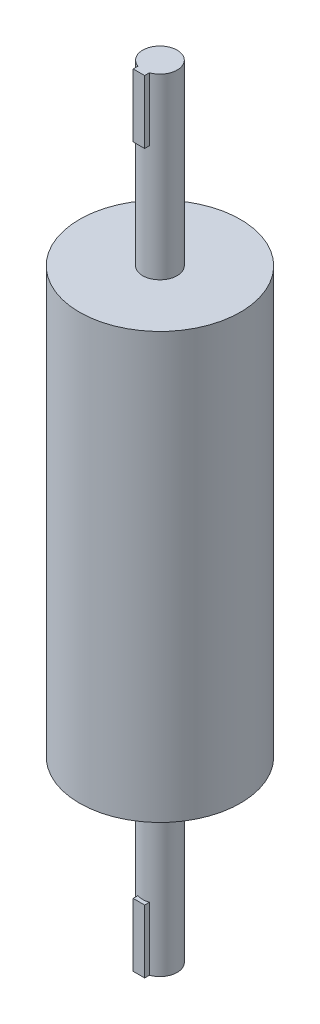
from build123d import *

# Parameters (mm, degrees)
SKETCH1_R            = 70
BOSS_EXTRUDE1_DEPTH  = 370
SKETCH2_R            = 10
BOSS_EXTRUDE2_DEPTH  = 100
BOSS_EXTRUDE3_START  = 100
SKETCH3_R            = 10
BOSS_EXTRUDE3_DEPTH  = 100
BOSS_EXTRUDE4_START  = -25
BOSS_EXTRUDE4_DEPTH  = 25
BOSS_EXTRUDE5_DEPTH  = 25
SKETCH6_R            = 15
BOSS_EXTRUDE6_DEPTH  = 570
BOSS_EXTRUDE7_START  = 55
SKETCH7_R            = 15
BOSS_EXTRUDE7_DEPTH  = 55
SKETCH8_R            = 15
BOSS_EXTRUDE8_DEPTH  = 55
BOSS_EXTRUDE9_DEPTH  = 55
BOSS_EXTRUDE10_START = -55
BOSS_EXTRUDE10_DEPTH = 55


with BuildPart() as part:
    # Sketch1 → Boss-Extrude1 (new body)
    with BuildSketch(Plane(origin=(0, 0, 0), x_dir=(1, 0, 0), z_dir=(0, 1, 0))):
        with Locations(Location((0, 0, 0), (0, 0, 270))):
            Circle(SKETCH1_R)
    extrude(amount=BOSS_EXTRUDE1_DEPTH)

    # Sketch2 → Boss-Extrude2 (add)
    with BuildSketch(Plane(origin=(0, 370, 0), x_dir=(1, 0, 0), z_dir=(0, 1, 0))):
        with Locations(Location((0, 0, 0), (0, 0, 270))):
            Circle(SKETCH2_R)
    extrude(amount=BOSS_EXTRUDE2_DEPTH)

    # Sketch3 → Boss-Extrude3 (add)
    with BuildSketch(Plane.XZ.offset(BOSS_EXTRUDE3_START)):
        with Locations(Location((0, 0, 0), (0, 0, 90))):
            Circle(SKETCH3_R)
    extrude(amount=-BOSS_EXTRUDE3_DEPTH)

    # Sketch4 → Boss-Extrude4 (add)
    with BuildSketch(Plane(origin=(0, 470, 0), x_dir=(1, 0, 0), z_dir=(0, 1, 0)).offset(BOSS_EXTRUDE4_START)):
        with BuildLine():
            Line((-5, 8.660254038), (-5, 12.820254038))
            Line((-5, 12.820254038), (5, 12.820254038))
            Line((5, 12.820254038), (5, 8.660254038))
            ThreePointArc((5, 8.660254038), (0, 10), (-5, 8.660254038))
        make_face()
    extrude(amount=BOSS_EXTRUDE4_DEPTH)

    # Sketch5 → Boss-Extrude5 (add)
    with BuildSketch(Plane.XZ.offset(100)):
        with BuildLine():
            Line((-5, 8.660254038), (-5, 12.820254038))
            Line((-5, 12.820254038), (5, 12.820254038))
            Line((5, 12.820254038), (5, 8.660254038))
            ThreePointArc((5, 8.660254038), (0, 10), (-5, 8.660254038))
        make_face()
    extrude(amount=-BOSS_EXTRUDE5_DEPTH)

    # Sketch6 → Boss-Extrude6 (add)
    with BuildSketch(Plane.XZ.offset(100)):
        with Locations(Location((0, 0, 0), (0, 0, 270))):
            Circle(SKETCH6_R)
    extrude(amount=-BOSS_EXTRUDE6_DEPTH)

    # Sketch7 → Boss-Extrude7 (add)
    with BuildSketch(Plane.XZ.offset(100).offset(BOSS_EXTRUDE7_START)):
        with Locations(Location((0, 0, 0), (0, 0, 270))):
            Circle(SKETCH7_R)
    extrude(amount=-BOSS_EXTRUDE7_DEPTH)

    # Sketch8 → Boss-Extrude8 (add)
    with BuildSketch(Plane(origin=(0, 470, 0), x_dir=(1, 0, 0), z_dir=(0, 1, 0))):
        with Locations(Location((0, 0, 0), (0, 0, 90))):
            Circle(SKETCH8_R)
    extrude(amount=BOSS_EXTRUDE8_DEPTH)

    # Sketch9 → Boss-Extrude9 (add)
    with BuildSketch(Plane.XZ.offset(155)):
        with BuildLine():
            Line((-5, 14.142135624), (-5, 18.302135624))
            Line((-5, 18.302135624), (5, 18.302135624))
            Line((5, 18.302135624), (5, 14.142135624))
            ThreePointArc((5, 14.142135624), (0, 15), (-5, 14.142135624))
        make_face()
    extrude(amount=-BOSS_EXTRUDE9_DEPTH)

    # Sketch10 → Boss-Extrude10 (add)
    with BuildSketch(Plane(origin=(0, 525, 0), x_dir=(1, 0, 0), z_dir=(0, 1, 0)).offset(BOSS_EXTRUDE10_START)):
        with BuildLine():
            Line((5, -14.142135624), (5, -18.302135624))
            Line((5, -18.302135624), (-5, -18.302135624))
            Line((-5, -18.302135624), (-5, -14.142135624))
            ThreePointArc((-5, -14.142135624), (0, -15), (5, -14.142135624))
        make_face()
    extrude(amount=BOSS_EXTRUDE10_DEPTH)


solid = part.part
